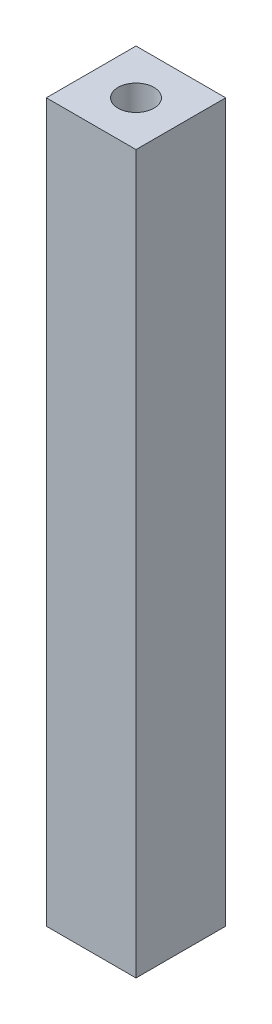
from build123d import *

# Parameters (mm, degrees)
SKETCH1_W                             = 12.7
SKETCH1_H                             = 12.7
BOSS_EXTRUDE1_DEPTH                   = 101.6
F_1_4_20_TAPPED_HOLE1_D               = 5.1054
F_1_4_20_TAPPED_HOLE1_DEPTH           = 16.51
F_1_4_20_TAPPED_HOLE1_TIP             = 1.533816902
F_1_4_20_TAPPED_HOLE1_ON_FACE_2_D     = 5.1054
F_1_4_20_TAPPED_HOLE1_ON_FACE_2_DEPTH = 16.51
F_1_4_20_TAPPED_HOLE1_ON_FACE_2_TIP   = 1.533816902


with BuildPart() as part:
    # Sketch1 → Boss-Extrude1 (new body)
    with BuildSketch(Plane(origin=(0, 0, 0), x_dir=(1, 0, 0), z_dir=(0, 1, 0))):
        with Locations((6.35, -6.35)):
            Rectangle(SKETCH1_W, SKETCH1_H)
    extrude(amount=BOSS_EXTRUDE1_DEPTH)

    # 1/4-20 Tapped Hole1
    with Locations(Plane(origin=(6.35, 0, 6.35), x_dir=(0, 0, -1), z_dir=(0, -1, 0))):
        with Locations((0, 0)):
            Hole(F_1_4_20_TAPPED_HOLE1_D / 2, depth=F_1_4_20_TAPPED_HOLE1_DEPTH)
            with Locations((0, 0, -(F_1_4_20_TAPPED_HOLE1_DEPTH + F_1_4_20_TAPPED_HOLE1_TIP / 2))):  # 118° drill point
                Cone(0, F_1_4_20_TAPPED_HOLE1_D / 2, F_1_4_20_TAPPED_HOLE1_TIP, mode=Mode.SUBTRACT)

    # 1/4-20 Tapped Hole1 on face 2
    with Locations(Plane(origin=(6.35, 101.6, 6.35), x_dir=(0, 0, 1), z_dir=(0, 1, 0))):
        with Locations((0, 0)):
            Hole(F_1_4_20_TAPPED_HOLE1_ON_FACE_2_D / 2, depth=F_1_4_20_TAPPED_HOLE1_ON_FACE_2_DEPTH)
            with Locations((0, 0, -(F_1_4_20_TAPPED_HOLE1_ON_FACE_2_DEPTH + F_1_4_20_TAPPED_HOLE1_ON_FACE_2_TIP / 2))):  # 118° drill point
                Cone(0, F_1_4_20_TAPPED_HOLE1_ON_FACE_2_D / 2, F_1_4_20_TAPPED_HOLE1_ON_FACE_2_TIP, mode=Mode.SUBTRACT)


solid = part.part
